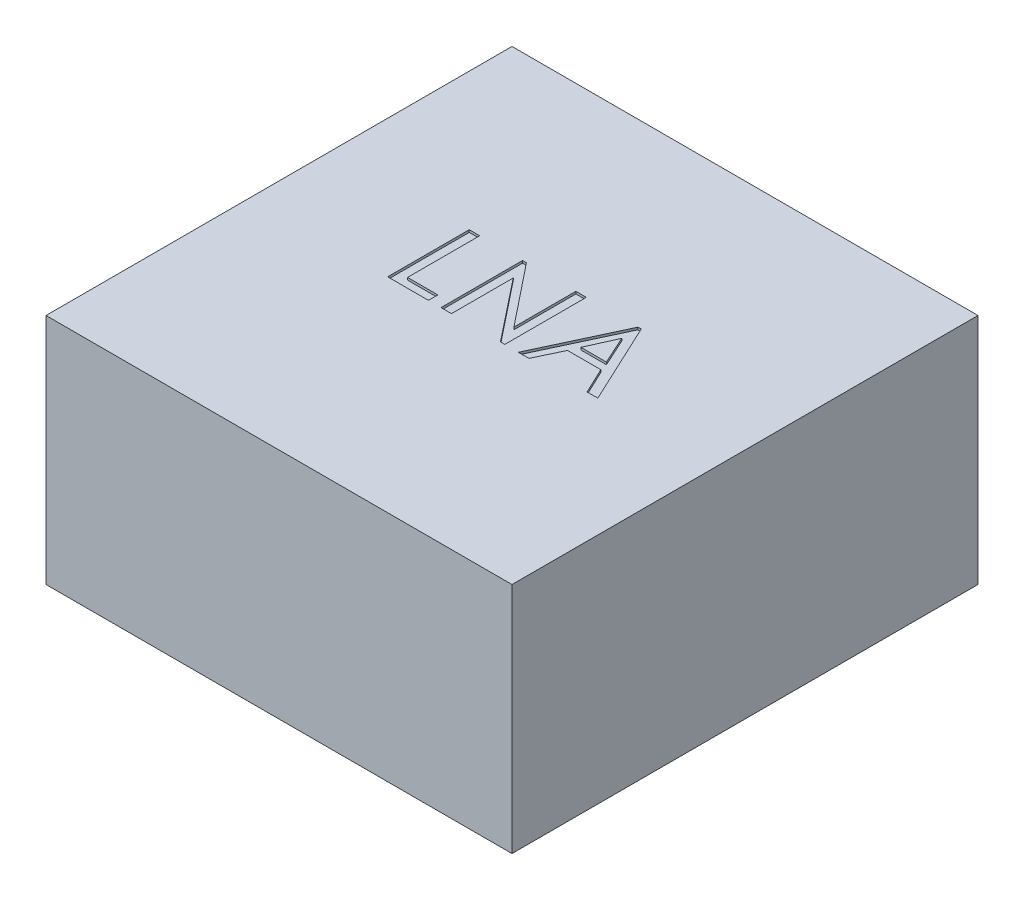
from build123d import *

# Parameters (mm, degrees)
SKETCH1_W           = 20
SKETCH1_H           = 20
BOSS_EXTRUDE1_DEPTH = 10
CUT_EXTRUDE1_DEPTH  = 0.1


with BuildPart() as part:
    # Sketch1 → Boss-Extrude1 (new body)
    with BuildSketch(Plane(origin=(0, 0, 0), x_dir=(1, 0, 0), z_dir=(0, 1, 0))):
        with Locations((10, 10)):
            Rectangle(SKETCH1_W, SKETCH1_H)
    extrude(amount=BOSS_EXTRUDE1_DEPTH)

    # Sketch2 → Cut-Extrude1 (cut)
    # profile 1 of 3: a face of its own
    with BuildSketch(Plane(origin=(0, 10, 0), x_dir=(1, 0, 0), z_dir=(0, 1, 0))):
        Polygon((5.894809539, 12.269793042), (6.343527487, 12.269793042), (6.343527487, 9.173639196), (7.644809539, 9.173639196), (7.644809539, 8.769793042), (5.894809539, 8.769793042), align=None)
    # profile 2 of 3: a face of its own
    with BuildSketch(Plane(origin=(0, 10, 0), x_dir=(1, 0, 0), z_dir=(0, 1, 0))):
        Polygon((8.183271077, 8.769793042), (8.183271077, 12.269793042), (8.349436943, 12.269793042), (10.471732616, 9.610438074), (10.471732616, 12.269793042), (10.920450564, 12.269793042), (10.920450564, 8.769793042), (10.736756654, 8.769793042), (8.631989026, 11.422136792), (8.631989026, 8.769793042), align=None)
    # profile 3 of 3: a face of its own
    with BuildSketch(Plane(origin=(0, 10, 0), x_dir=(1, 0, 0), z_dir=(0, 1, 0))):
        Polygon((13.276219795, 12.269793042), (14.914040308, 8.769793042), (14.453403289, 8.769793042), (13.921952968, 9.891587914), (12.490262263, 9.891587914), (11.958811943, 8.769793042), (11.503783898, 8.769793042), (13.135995436, 12.269793042), align=None)
        Polygon((13.206107616, 11.504869164), (12.661335981, 10.295434068), (13.756488225, 10.295434068), align=None, mode=Mode.SUBTRACT)
    extrude(amount=-CUT_EXTRUDE1_DEPTH, mode=Mode.SUBTRACT)


solid = part.part
